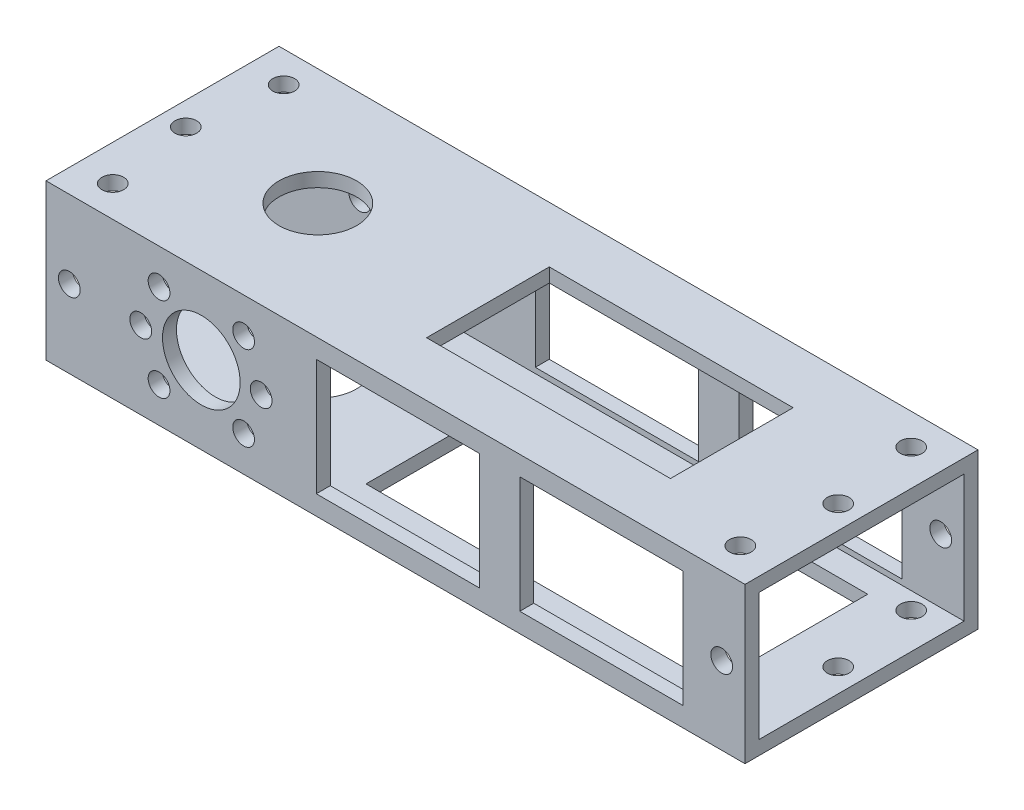
from build123d import *

# Parameters (mm, degrees)
SKETCH1_W           = 114.3
SKETCH1_H           = 38.1
BOSS_EXTRUDE1_DEPTH = 25.4
CUT_EXTRUDE1_REACH  = 125.131
SKETCH2_W           = 33.528
SKETCH2_H           = 20.828
CUT_EXTRUDE3_REACH  = 125.131
SKETCH4_R           = 1.778
CUT_EXTRUDE5_REACH  = 125.131
SKETCH6_R           = 1.778
SKETCH6_R_2         = 6.35
CUT_EXTRUDE6_REACH  = 125.131
SKETCH7_R           = 1.778
SKETCH7_R_2         = 6.35
CUT_EXTRUDE7_REACH  = 125.131
SKETCH8_R           = 1.778
SKETCH8_R_2         = 6.35
CUT_EXTRUDE9_REACH  = 125.131
SKETCH10_R          = 1.778


with BuildPart() as part:
    # Sketch1 → Boss-Extrude1 (new body)
    with BuildSketch(Plane(origin=(0, 0, 0), x_dir=(1, 0, 0), z_dir=(0, 1, 0))):
        with Locations((-57.15, -19.05)):
            Rectangle(SKETCH1_W, SKETCH1_H)
    extrude(amount=BOSS_EXTRUDE1_DEPTH)

    # Sketch2 → Cut-Extrude1 (cut, up to next)
    with BuildSketch(Plane(origin=(0, 0, 0), x_dir=(0, 0, -1), z_dir=(1, 0, 0)), mode=Mode.PRIVATE) as cut_extrude1_sk1:
        with Locations((-19.05, 12.7)):
            Rectangle(SKETCH2_W, SKETCH2_H)
    cut_extrude1_tool1 = extrude(cut_extrude1_sk1.sketch, amount=-CUT_EXTRUDE1_REACH, mode=Mode.PRIVATE) & part.part
    add(cut_extrude1_tool1.solids().sort_by_distance((0, 12.7, 19.05))[0], mode=Mode.SUBTRACT)

    # Cut-Extrude3: up to this face of the body (flat: up to its plane)
    cut_extrude3_end = Plane(part.part.faces().sort_by_distance((-57.15, 12.7, 38.1))[0])
    # Sketch4 → Cut-Extrude3 (cut, up to the picked face)
    with BuildSketch(Plane(origin=(0, 0, 0), x_dir=(-1, 0, 0), z_dir=(0, 0, -1)), mode=Mode.PRIVATE) as cut_extrude3_sk1:
        with Locations((3.81, 12.7)):
            Circle(SKETCH4_R)
    cut_extrude3_tool1 = split(extrude(cut_extrude3_sk1.sketch, amount=-CUT_EXTRUDE3_REACH, mode=Mode.PRIVATE), bisect_by=cut_extrude3_end, keep=Keep.BOTH, mode=Mode.PRIVATE)
    add(cut_extrude3_tool1.solids().sort_by(Axis((-3.81, 12.7, 0), (0, 0, 1)))[0], mode=Mode.SUBTRACT)

    # Cut-Extrude5: up to this face of the body (flat: up to its plane)
    cut_extrude5_end = Plane(part.part.faces().sort_by_distance((-57.333094227, 12.7, 38.1))[0])
    # Sketch6 → Cut-Extrude5 (cut, up to the picked face)
    with BuildSketch(Plane(origin=(0, 0, 0), x_dir=(-1, 0, 0), z_dir=(0, 0, -1)), mode=Mode.PRIVATE) as cut_extrude5_sk1:
        with Locations((110.49, 12.7)):
            Circle(SKETCH6_R)
    cut_extrude5_tool1 = split(extrude(cut_extrude5_sk1.sketch, amount=-CUT_EXTRUDE5_REACH, mode=Mode.PRIVATE), bisect_by=cut_extrude5_end, keep=Keep.BOTH, mode=Mode.PRIVATE)
    # Sketch6 → Cut-Extrude5 (cut, up to the picked face)
    with BuildSketch(Plane(origin=(0, 0, 0), x_dir=(-1, 0, 0), z_dir=(0, 0, -1)), mode=Mode.PRIVATE) as cut_extrude5_sk2:
        with Locations((88.9, 12.7)):
            Circle(SKETCH6_R_2)
    cut_extrude5_tool2 = split(extrude(cut_extrude5_sk2.sketch, amount=-CUT_EXTRUDE5_REACH, mode=Mode.PRIVATE), bisect_by=cut_extrude5_end, keep=Keep.BOTH, mode=Mode.PRIVATE)
    # Sketch6 → Cut-Extrude5 (cut, up to the picked face)
    with BuildSketch(Plane(origin=(0, 0, 0), x_dir=(-1, 0, 0), z_dir=(0, 0, -1)), mode=Mode.PRIVATE) as cut_extrude5_sk3:
        with Locations((81.985202787, 19.614797213)):
            Circle(SKETCH6_R)
    cut_extrude5_tool3 = split(extrude(cut_extrude5_sk3.sketch, amount=-CUT_EXTRUDE5_REACH, mode=Mode.PRIVATE), bisect_by=cut_extrude5_end, keep=Keep.BOTH, mode=Mode.PRIVATE)
    # Sketch6 → Cut-Extrude5 (cut, up to the picked face)
    with BuildSketch(Plane(origin=(0, 0, 0), x_dir=(-1, 0, 0), z_dir=(0, 0, -1)), mode=Mode.PRIVATE) as cut_extrude5_sk4:
        with Locations((95.814797213, 19.614797213)):
            Circle(SKETCH6_R)
    cut_extrude5_tool4 = split(extrude(cut_extrude5_sk4.sketch, amount=-CUT_EXTRUDE5_REACH, mode=Mode.PRIVATE), bisect_by=cut_extrude5_end, keep=Keep.BOTH, mode=Mode.PRIVATE)
    # Sketch6 → Cut-Extrude5 (cut, up to the picked face)
    with BuildSketch(Plane(origin=(0, 0, 0), x_dir=(-1, 0, 0), z_dir=(0, 0, -1)), mode=Mode.PRIVATE) as cut_extrude5_sk5:
        with Locations((95.814797213, 5.785202787)):
            Circle(SKETCH6_R)
    cut_extrude5_tool5 = split(extrude(cut_extrude5_sk5.sketch, amount=-CUT_EXTRUDE5_REACH, mode=Mode.PRIVATE), bisect_by=cut_extrude5_end, keep=Keep.BOTH, mode=Mode.PRIVATE)
    # Sketch6 → Cut-Extrude5 (cut, up to the picked face)
    with BuildSketch(Plane(origin=(0, 0, 0), x_dir=(-1, 0, 0), z_dir=(0, 0, -1)), mode=Mode.PRIVATE) as cut_extrude5_sk6:
        with Locations((81.985202787, 5.785202787)):
            Circle(SKETCH6_R)
    cut_extrude5_tool6 = split(extrude(cut_extrude5_sk6.sketch, amount=-CUT_EXTRUDE5_REACH, mode=Mode.PRIVATE), bisect_by=cut_extrude5_end, keep=Keep.BOTH, mode=Mode.PRIVATE)
    # Sketch6 → Cut-Extrude5 (cut, up to the picked face)
    with BuildSketch(Plane(origin=(0, 0, 0), x_dir=(-1, 0, 0), z_dir=(0, 0, -1)), mode=Mode.PRIVATE) as cut_extrude5_sk7:
        with Locations((79.121, 12.7)):
            Circle(SKETCH6_R)
    cut_extrude5_tool7 = split(extrude(cut_extrude5_sk7.sketch, amount=-CUT_EXTRUDE5_REACH, mode=Mode.PRIVATE), bisect_by=cut_extrude5_end, keep=Keep.BOTH, mode=Mode.PRIVATE)
    # Sketch6 → Cut-Extrude5 (cut, up to the picked face)
    with BuildSketch(Plane(origin=(0, 0, 0), x_dir=(-1, 0, 0), z_dir=(0, 0, -1)), mode=Mode.PRIVATE) as cut_extrude5_sk8:
        with Locations((98.806, 12.7)):
            Circle(SKETCH6_R)
    cut_extrude5_tool8 = split(extrude(cut_extrude5_sk8.sketch, amount=-CUT_EXTRUDE5_REACH, mode=Mode.PRIVATE), bisect_by=cut_extrude5_end, keep=Keep.BOTH, mode=Mode.PRIVATE)
    # Sketch6 → Cut-Extrude5 (cut, up to the picked face)
    with BuildSketch(Plane(origin=(0, 0, 0), x_dir=(-1, 0, 0), z_dir=(0, 0, -1)), mode=Mode.PRIVATE) as cut_extrude5_sk9:
        Polygon((10.16, 12.7), (10.16, 22.225), (36.83, 22.225), (36.83, 3.175), (10.16, 3.175), align=None)
    cut_extrude5_tool9 = split(extrude(cut_extrude5_sk9.sketch, amount=-CUT_EXTRUDE5_REACH, mode=Mode.PRIVATE), bisect_by=cut_extrude5_end, keep=Keep.BOTH, mode=Mode.PRIVATE)
    # Sketch6 → Cut-Extrude5 (cut, up to the picked face)
    with BuildSketch(Plane(origin=(0, 0, 0), x_dir=(-1, 0, 0), z_dir=(0, 0, -1)), mode=Mode.PRIVATE) as cut_extrude5_sk10:
        Polygon((43.434, 12.7), (43.434, 22.225), (70.104, 22.225), (70.104, 3.175), (43.434, 3.175), align=None)
    cut_extrude5_tool10 = split(extrude(cut_extrude5_sk10.sketch, amount=-CUT_EXTRUDE5_REACH, mode=Mode.PRIVATE), bisect_by=cut_extrude5_end, keep=Keep.BOTH, mode=Mode.PRIVATE)
    add(cut_extrude5_tool1.solids().sort_by(Axis((-110.49, 12.7, 0), (0, 0, 1)))[0], mode=Mode.SUBTRACT)
    add(cut_extrude5_tool2.solids().sort_by(Axis((-88.9, 12.7, 0), (0, 0, 1)))[0], mode=Mode.SUBTRACT)
    add(cut_extrude5_tool3.solids().sort_by(Axis((-81.985203, 19.614797, 0), (0, 0, 1)))[0], mode=Mode.SUBTRACT)
    add(cut_extrude5_tool4.solids().sort_by(Axis((-95.814797, 19.614797, 0), (0, 0, 1)))[0], mode=Mode.SUBTRACT)
    add(cut_extrude5_tool5.solids().sort_by(Axis((-95.814797, 5.785203, 0), (0, 0, 1)))[0], mode=Mode.SUBTRACT)
    add(cut_extrude5_tool6.solids().sort_by(Axis((-81.985203, 5.785203, 0), (0, 0, 1)))[0], mode=Mode.SUBTRACT)
    add(cut_extrude5_tool7.solids().sort_by(Axis((-79.121, 12.7, 0), (0, 0, 1)))[0], mode=Mode.SUBTRACT)
    add(cut_extrude5_tool8.solids().sort_by(Axis((-98.806, 12.7, 0), (0, 0, 1)))[0], mode=Mode.SUBTRACT)
    add(cut_extrude5_tool9.solids().sort_by(Axis((-23.495, 12.7, 0), (0, 0, 1)))[0], mode=Mode.SUBTRACT)
    add(cut_extrude5_tool10.solids().sort_by(Axis((-56.769, 12.7, 0), (0, 0, 1)))[0], mode=Mode.SUBTRACT)

    # Sketch7 → Cut-Extrude6 (cut, up to next)
    with BuildSketch(Plane(origin=(0, 25.4, 0), x_dir=(1, 0, 0), z_dir=(0, 1, 0)), mode=Mode.PRIVATE) as cut_extrude6_sk1:
        with Locations(Location((-110.49, -19.05, 0), (0, 0, 270))):
            Circle(SKETCH7_R)
    cut_extrude6_tool1 = extrude(cut_extrude6_sk1.sketch, amount=-CUT_EXTRUDE6_REACH, mode=Mode.PRIVATE) & part.part
    # Sketch7 → Cut-Extrude6 (cut, up to next)
    with BuildSketch(Plane(origin=(0, 25.4, 0), x_dir=(1, 0, 0), z_dir=(0, 1, 0)), mode=Mode.PRIVATE) as cut_extrude6_sk2:
        with Locations(Location((-88.9, -19.05, 0), (0, 0, 270))):
            Circle(SKETCH7_R_2)
    cut_extrude6_tool2 = extrude(cut_extrude6_sk2.sketch, amount=-CUT_EXTRUDE6_REACH, mode=Mode.PRIVATE) & part.part
    # Sketch7 → Cut-Extrude6 (cut, up to next)
    with BuildSketch(Plane(origin=(0, 25.4, 0), x_dir=(1, 0, 0), z_dir=(0, 1, 0)), mode=Mode.PRIVATE) as cut_extrude6_sk3:
        with Locations(Location((-108.458, -5.08, 0), (0, 0, 270))):
            Circle(SKETCH7_R)
    cut_extrude6_tool3 = extrude(cut_extrude6_sk3.sketch, amount=-CUT_EXTRUDE6_REACH, mode=Mode.PRIVATE) & part.part
    # Sketch7 → Cut-Extrude6 (cut, up to next)
    with BuildSketch(Plane(origin=(0, 25.4, 0), x_dir=(1, 0, 0), z_dir=(0, 1, 0)), mode=Mode.PRIVATE) as cut_extrude6_sk4:
        with Locations(Location((-108.458, -33.02, 0), (0, 0, 270))):
            Circle(SKETCH7_R)
    cut_extrude6_tool4 = extrude(cut_extrude6_sk4.sketch, amount=-CUT_EXTRUDE6_REACH, mode=Mode.PRIVATE) & part.part
    # Sketch7 → Cut-Extrude6 (cut, up to next)
    with BuildSketch(Plane(origin=(0, 25.4, 0), x_dir=(1, 0, 0), z_dir=(0, 1, 0)), mode=Mode.PRIVATE) as cut_extrude6_sk5:
        Polygon((-60.96, -19.05), (-60.96, -9.144), (-21.082, -9.144), (-21.082, -29.21), (-60.96, -29.21), align=None)
    cut_extrude6_tool5 = extrude(cut_extrude6_sk5.sketch, amount=-CUT_EXTRUDE6_REACH, mode=Mode.PRIVATE) & part.part
    add(cut_extrude6_tool1.solids().sort_by_distance((-110.49, 25.4, 19.05))[0], mode=Mode.SUBTRACT)
    add(cut_extrude6_tool2.solids().sort_by_distance((-88.9, 25.4, 19.05))[0], mode=Mode.SUBTRACT)
    add(cut_extrude6_tool3.solids().sort_by_distance((-108.458, 25.4, 5.08))[0], mode=Mode.SUBTRACT)
    add(cut_extrude6_tool4.solids().sort_by_distance((-108.458, 25.4, 33.02))[0], mode=Mode.SUBTRACT)
    add(cut_extrude6_tool5.solids().sort_by_distance((-41.021, 25.4, 19.177))[0], mode=Mode.SUBTRACT)

    # Sketch8 → Cut-Extrude7 (cut, up to next)
    with BuildSketch(Plane.XZ, mode=Mode.PRIVATE) as cut_extrude7_sk1:
        with Locations(Location((-110.49, 19.05, 0), (0, 0, 90))):
            Circle(SKETCH8_R)
    cut_extrude7_tool1 = extrude(cut_extrude7_sk1.sketch, amount=-CUT_EXTRUDE7_REACH, mode=Mode.PRIVATE) & part.part
    # Sketch8 → Cut-Extrude7 (cut, up to next)
    with BuildSketch(Plane.XZ, mode=Mode.PRIVATE) as cut_extrude7_sk2:
        with Locations(Location((-88.9, 19.05, 0), (0, 0, 90))):
            Circle(SKETCH8_R_2)
    cut_extrude7_tool2 = extrude(cut_extrude7_sk2.sketch, amount=-CUT_EXTRUDE7_REACH, mode=Mode.PRIVATE) & part.part
    # Sketch8 → Cut-Extrude7 (cut, up to next)
    with BuildSketch(Plane.XZ, mode=Mode.PRIVATE) as cut_extrude7_sk3:
        with Locations(Location((-108.458, 33.02, 0), (0, 0, 90))):
            Circle(SKETCH8_R)
    cut_extrude7_tool3 = extrude(cut_extrude7_sk3.sketch, amount=-CUT_EXTRUDE7_REACH, mode=Mode.PRIVATE) & part.part
    # Sketch8 → Cut-Extrude7 (cut, up to next)
    with BuildSketch(Plane.XZ, mode=Mode.PRIVATE) as cut_extrude7_sk4:
        with Locations(Location((-108.458, 5.08, 0), (0, 0, 90))):
            Circle(SKETCH8_R)
    cut_extrude7_tool4 = extrude(cut_extrude7_sk4.sketch, amount=-CUT_EXTRUDE7_REACH, mode=Mode.PRIVATE) & part.part
    # Sketch8 → Cut-Extrude7 (cut, up to next)
    with BuildSketch(Plane.XZ, mode=Mode.PRIVATE) as cut_extrude7_sk5:
        Polygon((-68.326, 19.05), (-68.326, 31.75), (-11.684, 31.75), (-11.684, 6.35), (-68.326, 6.35), align=None)
    cut_extrude7_tool5 = extrude(cut_extrude7_sk5.sketch, amount=-CUT_EXTRUDE7_REACH, mode=Mode.PRIVATE) & part.part
    add(cut_extrude7_tool1.solids().sort_by_distance((-110.49, 0, 19.05))[0], mode=Mode.SUBTRACT)
    add(cut_extrude7_tool2.solids().sort_by_distance((-88.9, 0, 19.05))[0], mode=Mode.SUBTRACT)
    add(cut_extrude7_tool3.solids().sort_by_distance((-108.458, 0, 33.02))[0], mode=Mode.SUBTRACT)
    add(cut_extrude7_tool4.solids().sort_by_distance((-108.458, 0, 5.08))[0], mode=Mode.SUBTRACT)
    add(cut_extrude7_tool5.solids().sort_by_distance((-40.005, 0, 19.05))[0], mode=Mode.SUBTRACT)

    # Cut-Extrude9: up to this face of the body (flat: up to its plane)
    cut_extrude9_end = Plane(part.part.faces().sort_by_distance((-57.15, 25.4, 1.204827789))[0])
    # Sketch10 → Cut-Extrude9 (cut, up to the picked face)
    with BuildSketch(Plane(origin=(0, 0, 0), x_dir=(-1, 0, 0), z_dir=(0, -1, 0)), mode=Mode.PRIVATE) as cut_extrude9_sk1:
        with Locations(Location((3.81, -19.05, 0), (0, 0, 90))):
            Circle(SKETCH10_R)
    cut_extrude9_tool1 = split(extrude(cut_extrude9_sk1.sketch, amount=-CUT_EXTRUDE9_REACH, mode=Mode.PRIVATE), bisect_by=cut_extrude9_end, keep=Keep.BOTH, mode=Mode.PRIVATE)
    # Sketch10 → Cut-Extrude9 (cut, up to the picked face)
    with BuildSketch(Plane(origin=(0, 0, 0), x_dir=(-1, 0, 0), z_dir=(0, -1, 0)), mode=Mode.PRIVATE) as cut_extrude9_sk2:
        with Locations(Location((5.842, -33.02, 0), (0, 0, 90))):
            Circle(SKETCH10_R)
    cut_extrude9_tool2 = split(extrude(cut_extrude9_sk2.sketch, amount=-CUT_EXTRUDE9_REACH, mode=Mode.PRIVATE), bisect_by=cut_extrude9_end, keep=Keep.BOTH, mode=Mode.PRIVATE)
    # Sketch10 → Cut-Extrude9 (cut, up to the picked face)
    with BuildSketch(Plane(origin=(0, 0, 0), x_dir=(-1, 0, 0), z_dir=(0, -1, 0)), mode=Mode.PRIVATE) as cut_extrude9_sk3:
        with Locations(Location((5.842, -5.08, 0), (0, 0, 90))):
            Circle(SKETCH10_R)
    cut_extrude9_tool3 = split(extrude(cut_extrude9_sk3.sketch, amount=-CUT_EXTRUDE9_REACH, mode=Mode.PRIVATE), bisect_by=cut_extrude9_end, keep=Keep.BOTH, mode=Mode.PRIVATE)
    add(cut_extrude9_tool1.solids().sort_by(Axis((-3.81, 0, 19.05), (0, 1, 0)))[0], mode=Mode.SUBTRACT)
    add(cut_extrude9_tool2.solids().sort_by(Axis((-5.842, 0, 33.02), (0, 1, 0)))[0], mode=Mode.SUBTRACT)
    add(cut_extrude9_tool3.solids().sort_by(Axis((-5.842, 0, 5.08), (0, 1, 0)))[0], mode=Mode.SUBTRACT)


solid = part.part
